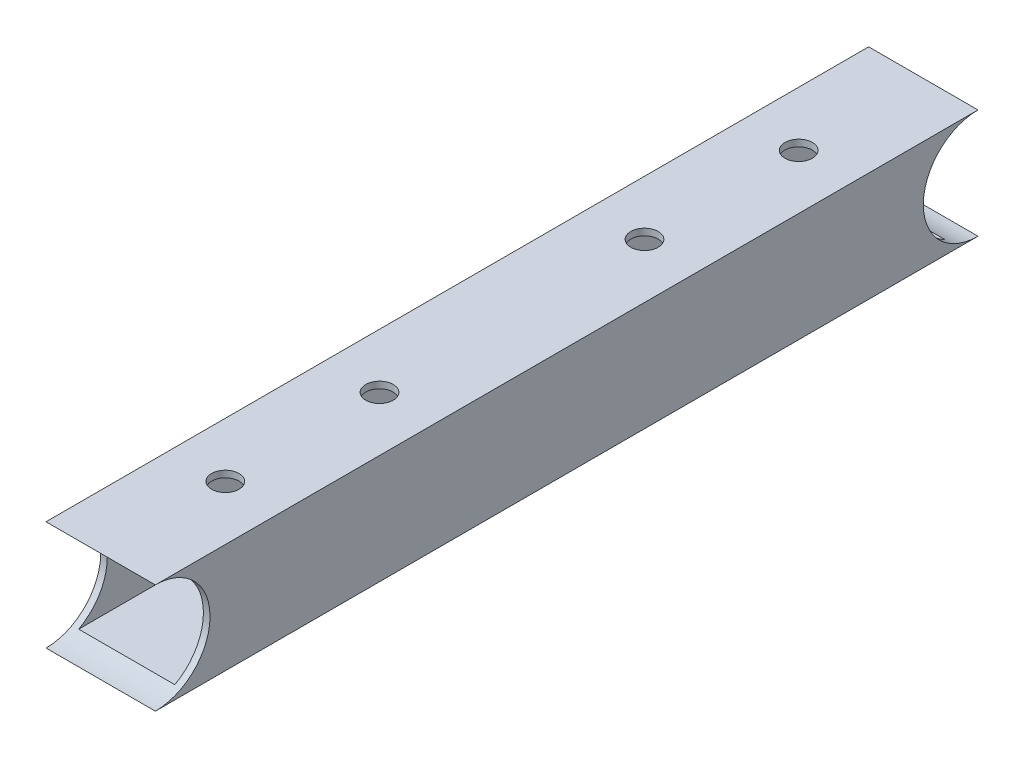
from build123d import *

# Parameters (mm, degrees)
SKETCH1_W           = 39.878
SKETCH1_H           = 39.878
SKETCH1_W_2         = 35.052
SKETCH1_H_2         = 35.052
BOSS_EXTRUDE1_DEPTH = 300
SKETCH2_R           = 19.939
CUT_EXTRUDE1_DEPTH  = 300
SKETCH3_R           = 5
CUT_EXTRUDE2_DEPTH  = 95


with BuildPart() as part:
    # Sketch1 → Boss-Extrude1 (new body)
    with BuildSketch(Plane.XY):
        Rectangle(SKETCH1_W, SKETCH1_H)
        Rectangle(SKETCH1_W_2, SKETCH1_H_2, mode=Mode.SUBTRACT)
    extrude(amount=BOSS_EXTRUDE1_DEPTH)

    # Sketch2 → Cut-Extrude1 (cut)
    with BuildSketch(Plane(origin=(19.939, 0, 0), x_dir=(0, 0, -1), z_dir=(1, 0, 0))):
        with Locations((-300, 0)):
            Circle(SKETCH2_R)
        Circle(SKETCH2_R)
    extrude(amount=-CUT_EXTRUDE1_DEPTH, mode=Mode.SUBTRACT)

    # Sketch3 → Cut-Extrude2 (cut)
    with BuildSketch(Plane(origin=(0, 19.939, 0), x_dir=(1, 0, 0), z_dir=(0, 1, 0))):
        with Locations(Location((0, -198.315, 0), (0, 0, 270))):
            Circle(SKETCH3_R)
        with Locations(Location((0, -254.545, 0), (0, 0, 270))):
            Circle(SKETCH3_R)
        with Locations(Location((0, -101.685, 0), (0, 0, 270))):
            Circle(SKETCH3_R)
        with Locations(Location((0, -45.455, 0), (0, 0, 270))):
            Circle(SKETCH3_R)
    extrude(amount=-CUT_EXTRUDE2_DEPTH, mode=Mode.SUBTRACT)


solid = part.part
